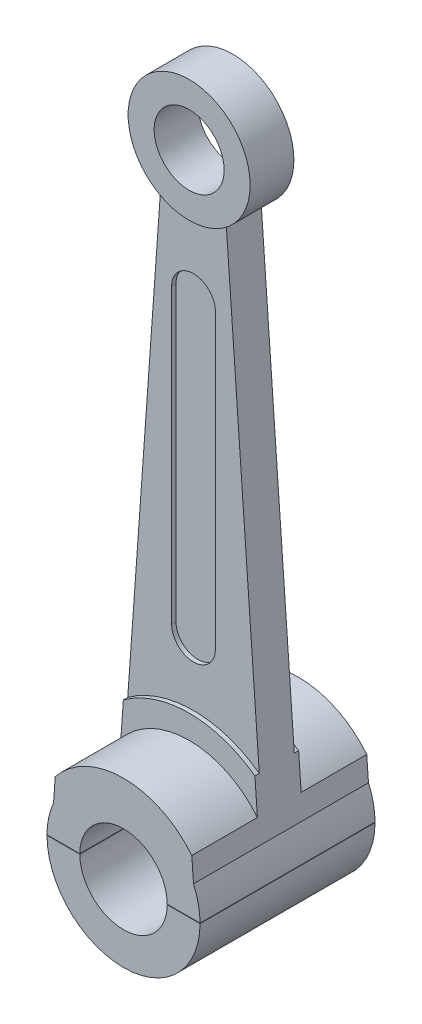
from build123d import *

# Parameters (mm, degrees)
SKETCH1_R                = 1.395
SKETCH1_R_2              = 0.8
BOSS_EXTRUDE1_DEPTH      = 0.5
SKETCH1_R_3              = 2.54
SKETCH1_R_4              = 1
BOSS_EXTRUDE1_2_DEPTH    = 0.5
BOSS_EXTRUDE2_DEPTH      = 0.4
BOSS_EXTRUDE3_DEPTH      = 0.3
BOSS_EXTRUDE4_DEPTH      = 1.5
BOSS_EXTRUDE4_DEPTH_BACK = 2.5
SKETCH2_R                = 2
SKETCH2_R_2              = 1
CUT_EXTRUDE1_DEPTH       = 16.427534638
CUT_EXTRUDE1_DEPTH_BACK  = 16.427534638
CUT_EXTRUDE2_DEPTH       = 16.317301492
CUT_EXTRUDE2_DEPTH_BACK  = 16.317301492
SKETCH4_W                = 5.880163942
SKETCH4_H                = 0.01


with BuildPart() as part:
    # Sketch1 → Boss-Extrude1 (new, symmetric)
    with BuildSketch(Plane.XY):
        with Locations((0, 13.69)):
            Circle(SKETCH1_R)
        with Locations((0, 13.69)):
            Circle(SKETCH1_R_2, mode=Mode.SUBTRACT)
    extrude(amount=BOSS_EXTRUDE1_DEPTH, both=True)



with BuildPart() as body_2:
    # Sketch1 → Boss-Extrude1 2 (new, symmetric)
    with BuildSketch(Plane.XY):
        Circle(SKETCH1_R_3)
        Circle(SKETCH1_R_4, mode=Mode.SUBTRACT)
    extrude(amount=BOSS_EXTRUDE1_2_DEPTH, both=True)


with BuildPart() as part_1:
    add(part.part)

    add(body_2.part)  # Boss-Extrude2 merges body 2
    # Sketch1<3> → Boss-Extrude2 (add, symmetric)
    with BuildSketch(Plane.XY):
        with BuildLine():
            ThreePointArc((0.75, 12.513766605), (0, 12.295), (-0.75, 12.513766605))
            Line((-0.75, 12.513766605), (-1.65, 1.931087776))
            ThreePointArc((-1.65, 1.931087776), (0, 2.54), (1.65, 1.931087776))
            Line((1.65, 1.931087776), (0.75, 12.513766605))
        make_face()
        with BuildLine():
            ThreePointArc((-0.5, 10.69), (0, 11.19), (0.5, 10.69))
            Line((0.5, 10.69), (0.5, 4))
            ThreePointArc((0.5, 4), (0, 3.5), (-0.5, 4))
            Line((-0.5, 4), (-0.5, 10.69))
        make_face(mode=Mode.SUBTRACT)
    extrude(amount=BOSS_EXTRUDE2_DEPTH, both=True)

    # Sketch1<4> → Boss-Extrude3 (add, symmetric)
    with BuildSketch(Plane.XY):
        with BuildLine():
            Line((0.5, 10.69), (0.5, 4))
            ThreePointArc((0.5, 4), (0, 3.5), (-0.5, 4))
            Line((-0.5, 4), (-0.5, 10.69))
            ThreePointArc((-0.5, 10.69), (0, 11.19), (0.5, 10.69))
        make_face()
    extrude(amount=BOSS_EXTRUDE3_DEPTH, both=True)

    # Sketch2 → Boss-Extrude4 (add, two sides: drawn at the far end of the back side and taken through both)
    with BuildSketch(Plane.XY.offset(0.5).offset(-BOSS_EXTRUDE4_DEPTH_BACK)):
        Circle(SKETCH2_R)
        Circle(SKETCH2_R_2, mode=Mode.SUBTRACT)
    extrude(amount=BOSS_EXTRUDE4_DEPTH + BOSS_EXTRUDE4_DEPTH_BACK)

    # Sketch3 → Cut-Extrude1 (cut, two sides: drawn at the far end of the back side and taken through both)
    with BuildSketch(Plane.XY.offset(-CUT_EXTRUDE1_DEPTH_BACK)):
        with BuildLine():
            Line((-0.75, 12.513766605), (-3.040617263, 1.733391663))
            ThreePointArc((-3.040617263, 1.733391663), (0, -3.5), (3.040617263, 1.733391663))
            Line((3.040617263, 1.733391663), (0.75, 12.513766605))
            Line((0.75, 12.513766605), (1.6, 0.708872344))
            ThreePointArc((1.6, 0.708872344), (0, -1.75), (-1.6, 0.708872344))
            Line((-1.6, 0.708872344), (-0.75, 12.513766605))
        make_face()
    extrude(amount=CUT_EXTRUDE1_DEPTH + CUT_EXTRUDE1_DEPTH_BACK, mode=Mode.SUBTRACT)

    # Sketch4 → Cut-Extrude2 (cut, two sides: drawn at the far end of the back side and taken through both)
    with BuildSketch(Plane.XY.offset(-CUT_EXTRUDE2_DEPTH_BACK)):
        Rectangle(SKETCH4_W, SKETCH4_H)
    extrude(amount=CUT_EXTRUDE2_DEPTH + CUT_EXTRUDE2_DEPTH_BACK, mode=Mode.SUBTRACT)


with BuildPart() as cut_extrude2_piece_1:
    # of the separate pieces the step leaves, piece 1, a body of its own (cut_extrude2_pieces)
    add(part_1.part.solids().sort_by_distance((1.503641437, 2.047110751, -0.5))[0])


with BuildPart() as cut_extrude2_piece_2:
    # of the separate pieces the step leaves, piece 2, a body of its own (cut_extrude2_pieces)
    add(part_1.part.solids().sort_by_distance((1.749992857, -0.005, -2))[0])


solid = Compound([cut_extrude2_piece_1.part, cut_extrude2_piece_2.part])
